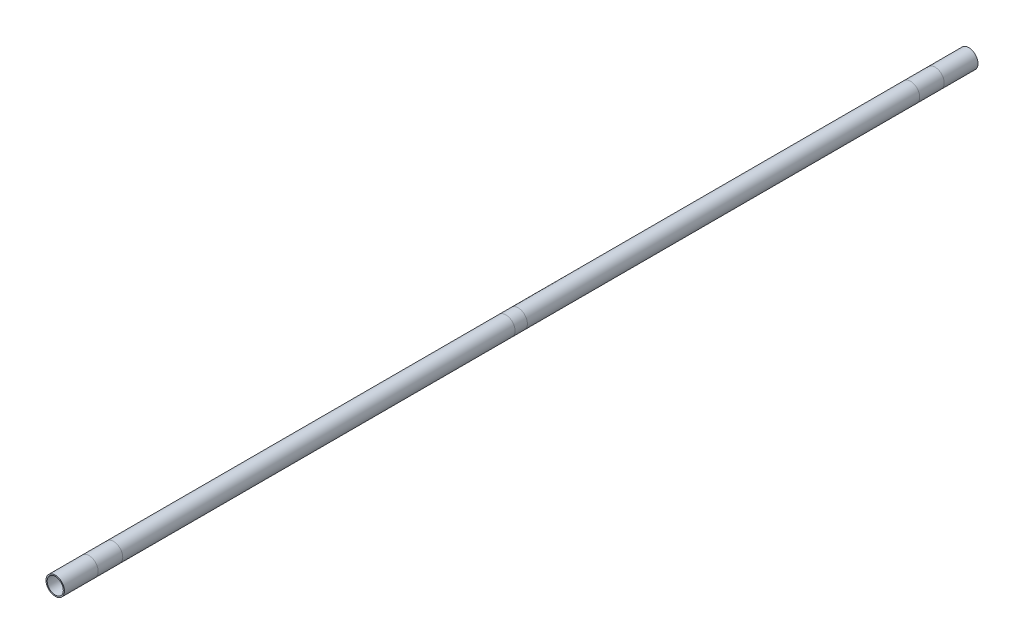
from build123d import *

# Parameters (mm, degrees)
PIPE_SECTION_60_3_X_3_91_R   = 30.15
PIPE_SECTION_60_3_X_3_91_R_2 = 26.24
GUIDE_POLE_2IN_SCH_40S_DEPTH = 2978


with BuildPart() as part:
    # Pipe section 60.3 x 3.91 → Guide pole 2in Sch 40S (new body)
    with BuildSketch(Plane.XY):
        Circle(PIPE_SECTION_60_3_X_3_91_R)
        Circle(PIPE_SECTION_60_3_X_3_91_R_2, mode=Mode.SUBTRACT)
    extrude(amount=GUIDE_POLE_2IN_SCH_40S_DEPTH)


solid = part.part
